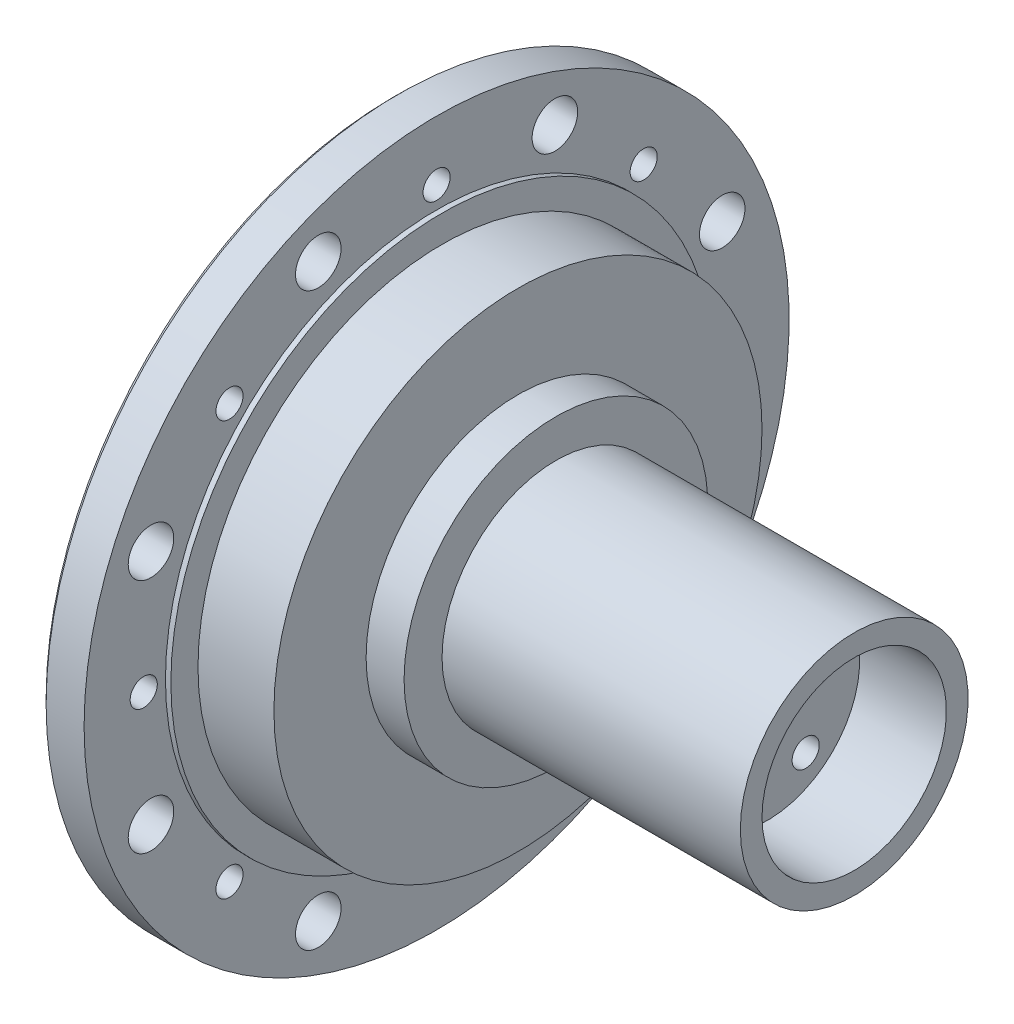
from build123d import *

# Parameters (mm, degrees)
CUT_EXTRUDE1_START = -3
SKETCH2_R          = 32.5
CUT_EXTRUDE1_DEPTH = 3
SKETCH3_R          = 1.25
CUT_EXTRUDE2_DEPTH = 12
CUT_EXTRUDE3_REACH = 64.6
SKETCH4_R          = 1.25
SKETCH4_R_2        = 2.1
CHAMFER1_SIZE      = 0.5
CHAMFER2_SIZE      = 0.5


with BuildPart() as part:
    # Sketch1 → Revolve1 (revolve)
    with BuildSketch(Plane.YX, mode=Mode.PRIVATE) as revolve1_sk:
        Polygon((-32.5, -4.5), (-32.5, -0.5), (-25, -0.5), (-25, 0), (-22.5, 0), (-22.5, 7), (-14, 7), (-14, 10.5), (-10.5, 10.5), (-10.5, 38), (-8.5, 38), (-8.5, 30), (0, 30), (0, 9.5), (-8, 9.5), (-8, 4.5), (-20, 4.5), (-20, -7.5), (-24, -7.5), (-24, -4.5), align=None)
    revolve(revolve1_sk.sketch.rotate(Axis((0, 0, 0), (1, 0, 0)), 270), axis=Axis((0, 0, 0), (1, 0, 0)))

    # Sketch2 → Cut-Extrude1 (cut)
    with BuildSketch(Plane.ZY.offset(7.5).offset(CUT_EXTRUDE1_START)):
        Circle(SKETCH2_R)
        with BuildLine():
            Line((-8.94427191, 22), (8.94427191, 22))
            ThreePointArc((8.94427191, 22), (9.598925581, 21.927700219), (10.22202504, 21.714285714))
            ThreePointArc((10.22202504, 21.714285714), (16.970562748, 16.970562748), (21.714285714, 10.22202504))
            ThreePointArc((21.714285714, 10.22202504), (21.927700219, 9.598925581), (22, 8.94427191))
            Line((22, 8.94427191), (22, -8.94427191))
            ThreePointArc((22, -8.94427191), (21.927700219, -9.598925581), (21.714285714, -10.22202504))
            ThreePointArc((21.714285714, -10.22202504), (16.970562748, -16.970562748), (10.22202504, -21.714285714))
            ThreePointArc((10.22202504, -21.714285714), (9.598925581, -21.927700219), (8.94427191, -22))
            Line((8.94427191, -22), (-8.94427191, -22))
            ThreePointArc((-8.94427191, -22), (-9.598925581, -21.927700219), (-10.22202504, -21.714285714))
            ThreePointArc((-10.22202504, -21.714285714), (-16.970562748, -16.970562748), (-21.714285714, -10.22202504))
            ThreePointArc((-21.714285714, -10.22202504), (-21.927700219, -9.598925581), (-22, -8.94427191))
            Line((-22, -8.94427191), (-22, 8.94427191))
            ThreePointArc((-22, 8.94427191), (-21.927700219, 9.598925581), (-21.714285714, 10.22202504))
            ThreePointArc((-21.714285714, 10.22202504), (-16.970562748, 16.970562748), (-10.22202504, 21.714285714))
            ThreePointArc((-10.22202504, 21.714285714), (-9.598925581, 21.927700219), (-8.94427191, 22))
        make_face(mode=Mode.SUBTRACT)
    extrude(amount=CUT_EXTRUDE1_DEPTH, mode=Mode.SUBTRACT)

    # Sketch3 → Cut-Extrude2 (cut)
    with BuildSketch(Plane(origin=(30, 0, 0), x_dir=(0, 0, -1), z_dir=(1, 0, 0))):
        with Locations((0, 6)):
            Circle(SKETCH3_R)
        with Locations((5.706339098, 1.854101966)):
            Circle(SKETCH3_R)
        with Locations((3.526711514, -4.854101966)):
            Circle(SKETCH3_R)
        with Locations((-3.526711514, -4.854101966)):
            Circle(SKETCH3_R)
        with Locations((-5.706339098, 1.854101966)):
            Circle(SKETCH3_R)
    extrude(amount=-CUT_EXTRUDE2_DEPTH, mode=Mode.SUBTRACT)

    # Sketch4 → Cut-Extrude3 (cut, up to next)
    with BuildSketch(Plane.ZY.offset(4.5), mode=Mode.PRIVATE) as cut_extrude3_sk1:
        with Locations((0, 27)):
            Circle(SKETCH4_R)
    cut_extrude3_tool1 = extrude(cut_extrude3_sk1.sketch, amount=-CUT_EXTRUDE3_REACH, mode=Mode.PRIVATE) & part.part
    # Sketch4 → Cut-Extrude3 (cut, up to next)
    with BuildSketch(Plane.ZY.offset(4.5), mode=Mode.PRIVATE) as cut_extrude3_sk2:
        with Locations((10.906477822, 26.330566677)):
            Circle(SKETCH4_R_2)
    cut_extrude3_tool2 = extrude(cut_extrude3_sk2.sketch, amount=-CUT_EXTRUDE3_REACH, mode=Mode.PRIVATE) & part.part
    # Sketch4 → Cut-Extrude3 (cut, up to next)
    with BuildSketch(Plane.ZY.offset(4.5), mode=Mode.PRIVATE) as cut_extrude3_sk3:
        with Locations((19.091883092, 19.091883092)):
            Circle(SKETCH4_R)
    cut_extrude3_tool3 = extrude(cut_extrude3_sk3.sketch, amount=-CUT_EXTRUDE3_REACH, mode=Mode.PRIVATE) & part.part
    # Sketch4 → Cut-Extrude3 (cut, up to next)
    with BuildSketch(Plane.ZY.offset(4.5), mode=Mode.PRIVATE) as cut_extrude3_sk4:
        with Locations((26.330566677, 10.906477822)):
            Circle(SKETCH4_R_2)
    cut_extrude3_tool4 = extrude(cut_extrude3_sk4.sketch, amount=-CUT_EXTRUDE3_REACH, mode=Mode.PRIVATE) & part.part
    # Sketch4 → Cut-Extrude3 (cut, up to next)
    with BuildSketch(Plane.ZY.offset(4.5), mode=Mode.PRIVATE) as cut_extrude3_sk5:
        with Locations((27, 0)):
            Circle(SKETCH4_R)
    cut_extrude3_tool5 = extrude(cut_extrude3_sk5.sketch, amount=-CUT_EXTRUDE3_REACH, mode=Mode.PRIVATE) & part.part
    # Sketch4 → Cut-Extrude3 (cut, up to next)
    with BuildSketch(Plane.ZY.offset(4.5), mode=Mode.PRIVATE) as cut_extrude3_sk6:
        with Locations((26.330566677, -10.906477822)):
            Circle(SKETCH4_R_2)
    cut_extrude3_tool6 = extrude(cut_extrude3_sk6.sketch, amount=-CUT_EXTRUDE3_REACH, mode=Mode.PRIVATE) & part.part
    # Sketch4 → Cut-Extrude3 (cut, up to next)
    with BuildSketch(Plane.ZY.offset(4.5), mode=Mode.PRIVATE) as cut_extrude3_sk7:
        with Locations((19.091883092, -19.091883092)):
            Circle(SKETCH4_R)
    cut_extrude3_tool7 = extrude(cut_extrude3_sk7.sketch, amount=-CUT_EXTRUDE3_REACH, mode=Mode.PRIVATE) & part.part
    # Sketch4 → Cut-Extrude3 (cut, up to next)
    with BuildSketch(Plane.ZY.offset(4.5), mode=Mode.PRIVATE) as cut_extrude3_sk8:
        with Locations((10.906477822, -26.330566677)):
            Circle(SKETCH4_R_2)
    cut_extrude3_tool8 = extrude(cut_extrude3_sk8.sketch, amount=-CUT_EXTRUDE3_REACH, mode=Mode.PRIVATE) & part.part
    # Sketch4 → Cut-Extrude3 (cut, up to next)
    with BuildSketch(Plane.ZY.offset(4.5), mode=Mode.PRIVATE) as cut_extrude3_sk9:
        with Locations((0, -27)):
            Circle(SKETCH4_R)
    cut_extrude3_tool9 = extrude(cut_extrude3_sk9.sketch, amount=-CUT_EXTRUDE3_REACH, mode=Mode.PRIVATE) & part.part
    # Sketch4 → Cut-Extrude3 (cut, up to next)
    with BuildSketch(Plane.ZY.offset(4.5), mode=Mode.PRIVATE) as cut_extrude3_sk10:
        with Locations((-10.906477822, -26.330566677)):
            Circle(SKETCH4_R_2)
    cut_extrude3_tool10 = extrude(cut_extrude3_sk10.sketch, amount=-CUT_EXTRUDE3_REACH, mode=Mode.PRIVATE) & part.part
    # Sketch4 → Cut-Extrude3 (cut, up to next)
    with BuildSketch(Plane.ZY.offset(4.5), mode=Mode.PRIVATE) as cut_extrude3_sk11:
        with Locations((-19.091883092, -19.091883092)):
            Circle(SKETCH4_R)
    cut_extrude3_tool11 = extrude(cut_extrude3_sk11.sketch, amount=-CUT_EXTRUDE3_REACH, mode=Mode.PRIVATE) & part.part
    # Sketch4 → Cut-Extrude3 (cut, up to next)
    with BuildSketch(Plane.ZY.offset(4.5), mode=Mode.PRIVATE) as cut_extrude3_sk12:
        with Locations((-26.330566677, -10.906477822)):
            Circle(SKETCH4_R_2)
    cut_extrude3_tool12 = extrude(cut_extrude3_sk12.sketch, amount=-CUT_EXTRUDE3_REACH, mode=Mode.PRIVATE) & part.part
    # Sketch4 → Cut-Extrude3 (cut, up to next)
    with BuildSketch(Plane.ZY.offset(4.5), mode=Mode.PRIVATE) as cut_extrude3_sk13:
        with Locations((-27, 0)):
            Circle(SKETCH4_R)
    cut_extrude3_tool13 = extrude(cut_extrude3_sk13.sketch, amount=-CUT_EXTRUDE3_REACH, mode=Mode.PRIVATE) & part.part
    # Sketch4 → Cut-Extrude3 (cut, up to next)
    with BuildSketch(Plane.ZY.offset(4.5), mode=Mode.PRIVATE) as cut_extrude3_sk14:
        with Locations((-26.330566677, 10.906477822)):
            Circle(SKETCH4_R_2)
    cut_extrude3_tool14 = extrude(cut_extrude3_sk14.sketch, amount=-CUT_EXTRUDE3_REACH, mode=Mode.PRIVATE) & part.part
    # Sketch4 → Cut-Extrude3 (cut, up to next)
    with BuildSketch(Plane.ZY.offset(4.5), mode=Mode.PRIVATE) as cut_extrude3_sk15:
        with Locations((-19.091883092, 19.091883092)):
            Circle(SKETCH4_R)
    cut_extrude3_tool15 = extrude(cut_extrude3_sk15.sketch, amount=-CUT_EXTRUDE3_REACH, mode=Mode.PRIVATE) & part.part
    # Sketch4 → Cut-Extrude3 (cut, up to next)
    with BuildSketch(Plane.ZY.offset(4.5), mode=Mode.PRIVATE) as cut_extrude3_sk16:
        with Locations((-10.906477822, 26.330566677)):
            Circle(SKETCH4_R_2)
    cut_extrude3_tool16 = extrude(cut_extrude3_sk16.sketch, amount=-CUT_EXTRUDE3_REACH, mode=Mode.PRIVATE) & part.part
    add(cut_extrude3_tool1.solids().sort_by_distance((-4.5, 27, 0))[0], mode=Mode.SUBTRACT)
    add(cut_extrude3_tool2.solids().sort_by_distance((-4.5, 26.330567, 10.906478))[0], mode=Mode.SUBTRACT)
    add(cut_extrude3_tool3.solids().sort_by_distance((-4.5, 19.091883, 19.091883))[0], mode=Mode.SUBTRACT)
    add(cut_extrude3_tool4.solids().sort_by_distance((-4.5, 10.906478, 26.330567))[0], mode=Mode.SUBTRACT)
    add(cut_extrude3_tool5.solids().sort_by_distance((-4.5, 0, 27))[0], mode=Mode.SUBTRACT)
    add(cut_extrude3_tool6.solids().sort_by_distance((-4.5, -10.906478, 26.330567))[0], mode=Mode.SUBTRACT)
    add(cut_extrude3_tool7.solids().sort_by_distance((-4.5, -19.091883, 19.091883))[0], mode=Mode.SUBTRACT)
    add(cut_extrude3_tool8.solids().sort_by_distance((-4.5, -26.330567, 10.906478))[0], mode=Mode.SUBTRACT)
    add(cut_extrude3_tool9.solids().sort_by_distance((-4.5, -27, 0))[0], mode=Mode.SUBTRACT)
    add(cut_extrude3_tool10.solids().sort_by_distance((-4.5, -26.330567, -10.906478))[0], mode=Mode.SUBTRACT)
    add(cut_extrude3_tool11.solids().sort_by_distance((-4.5, -19.091883, -19.091883))[0], mode=Mode.SUBTRACT)
    add(cut_extrude3_tool12.solids().sort_by_distance((-4.5, -10.906478, -26.330567))[0], mode=Mode.SUBTRACT)
    add(cut_extrude3_tool13.solids().sort_by_distance((-4.5, 0, -27))[0], mode=Mode.SUBTRACT)
    add(cut_extrude3_tool14.solids().sort_by_distance((-4.5, 10.906478, -26.330567))[0], mode=Mode.SUBTRACT)
    add(cut_extrude3_tool15.solids().sort_by_distance((-4.5, 19.091883, -19.091883))[0], mode=Mode.SUBTRACT)
    add(cut_extrude3_tool16.solids().sort_by_distance((-4.5, 26.330567, -10.906478))[0], mode=Mode.SUBTRACT)

    # Chamfer1
    chamfer1_edges = [part.edges().sort_by_distance(p)[0] for p in [
        (-7.5, 16.970562748, 16.970562748),
        (-7.5, 0, -20),
        (-7.5, 16.970562748, -16.970562748),
        (-7.5, -16.970562748, -16.970562748),
        (-7.5, -16.970562748, 16.970562748),
        (-7.5, -9.598925581, 21.927700219),
        (-7.5, -21.927700219, 9.598925581),
        (-7.5, -22, 0),
        (-7.5, -21.927700219, -9.598925581),
        (-7.5, -9.598925581, -21.927700219),
        (-7.5, 0, -22),
        (-7.5, 9.598925581, -21.927700219),
        (-7.5, 21.927700219, -9.598925581),
        (-7.5, 22, 0),
        (-7.5, 21.927700219, 9.598925581),
        (-7.5, 9.598925581, 21.927700219),
        (-7.5, 0, 22),
    ]]
    chamfer(chamfer1_edges, length=CHAMFER1_SIZE)

    # Chamfer2
    chamfer2_edges = [part.edges().sort_by_distance(p)[0] for p in [
        (-4.5, 0, -32.5),
    ]]
    chamfer(chamfer2_edges, length=CHAMFER2_SIZE)


solid = part.part
